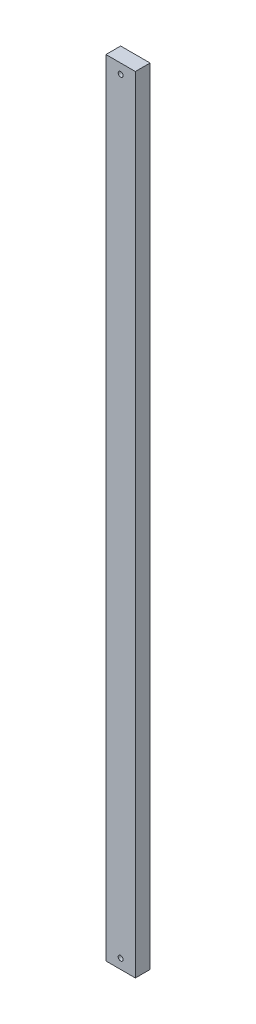
from build123d import *

# Parameters (mm, degrees)
SKETCH1_W           = 38.1
SKETCH1_H           = 19.05
BOSS_EXTRUDE1_DEPTH = 1016
SKETCH2_R           = 3.175
CUT_EXTRUDE1_DEPTH  = 1016


with BuildPart() as part:
    # Sketch1 → Boss-Extrude1 (new body)
    with BuildSketch(Plane(origin=(0, 0, 0), x_dir=(1, 0, 0), z_dir=(0, 1, 0))):
        Rectangle(SKETCH1_W, SKETCH1_H)
    extrude(amount=BOSS_EXTRUDE1_DEPTH)

    # Sketch2 → Cut-Extrude1 (cut)
    with BuildSketch(Plane.XY.offset(9.525)):
        with Locations((0, 12.7)):
            Circle(SKETCH2_R)
        with Locations((0, 1003.3)):
            Circle(SKETCH2_R)
    extrude(amount=-CUT_EXTRUDE1_DEPTH, mode=Mode.SUBTRACT)


solid = part.part
